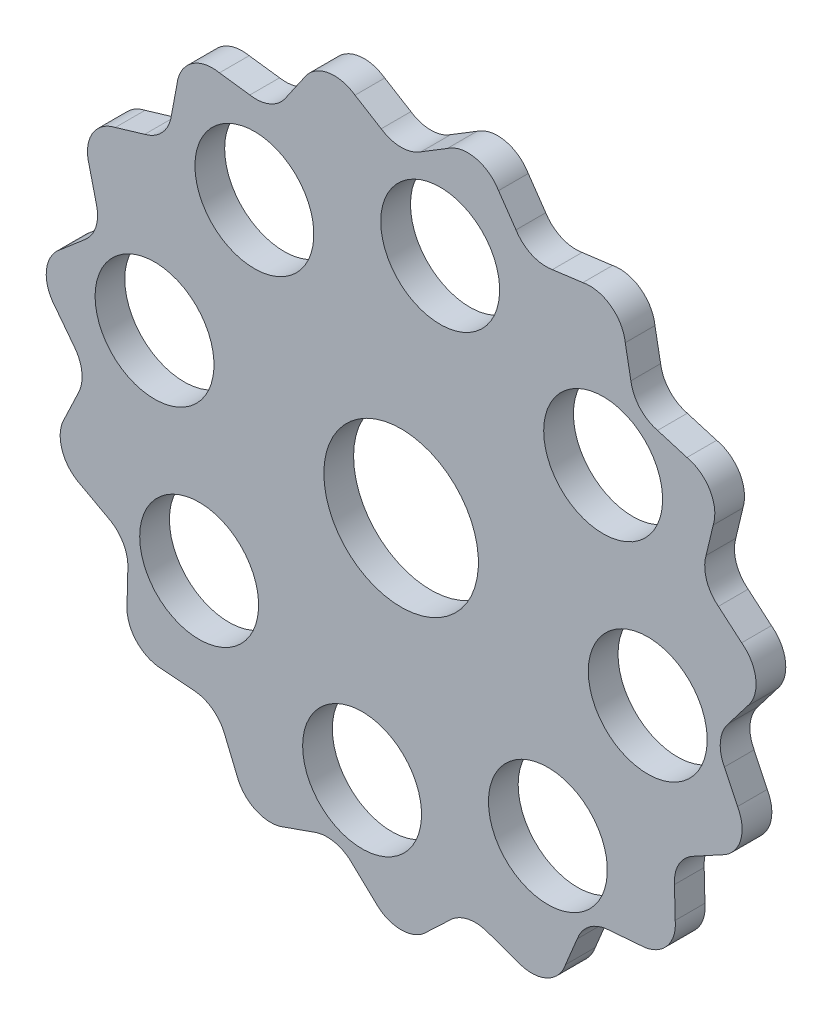
from build123d import *

# Parameters (mm, degrees)
BOSS_EXTRU_1_DEPTH      = 5
ESQUISSE2_R             = 13
ESQUISSE2_R_2           = 10
ENL_V_MAT_EXTRU_1_DEPTH = 85.791446444


with BuildPart() as part:
    # Esquisse1 → Boss.-Extru.1 (new body)
    with BuildSketch(Plane.XY):
        with BuildLine():
            Line((-7.756063007, 57.713945373), (-3.353460657, 55.024630504))
            ThreePointArc((-3.353460657, 55.024630504), (0, 54), (3.353460657, 55.024630504))
            Line((3.353460657, 55.024630504), (7.756063007, 57.713945373))
            ThreePointArc((7.756063007, 57.713945373), (10.013220978, 58.695868578), (12.474701449, 58.688856044))
            ThreePointArc((12.474701449, 58.688856044), (14.726228007, 57.694088008), (16.388860271, 55.878987669))
            Line((16.388860271, 55.878987669), (19.316994747, 51.631476586))
            ThreePointArc((19.316994747, 51.631476586), (21.963778726, 49.331454713), (25.444072249, 48.903525925))
            Line((25.444072249, 48.903525925), (30.559892529, 49.569637607))
            ThreePointArc((30.559892529, 49.569637607), (33.021293088, 49.548600235), (35.267115138, 48.541019662))
            ThreePointArc((35.267115138, 48.541019662), (36.919378386, 46.716475488), (37.700000719, 44.382045352))
            Line((37.700000719, 44.382045352), (38.64736627, 39.310771309))
            ThreePointArc((38.64736627, 39.310771309), (40.129820576, 36.133052743), (43.135172596, 34.326557439))
            Line((43.135172596, 34.326557439), (48.079639004, 32.854289173))
            ThreePointArc((48.079639004, 32.854289173), (50.319683635, 31.833928776), (51.961524227, 30))
            ThreePointArc((51.961524227, 30), (52.72883284, 27.66115995), (52.49246855, 25.211044196))
            Line((52.49246855, 25.211044196), (51.295257065, 20.192876545))
            ThreePointArc((51.295257065, 20.192876545), (51.35705188, 16.686917696), (53.367809731, 13.814215325))
            Line((53.367809731, 13.814215325), (57.285979107, 10.45813567))
            ThreePointArc((57.285979107, 10.45813567), (58.917343741, 8.61488183), (59.671313722, 6.271707796))
            ThreePointArc((59.671313722, 6.271707796), (59.420993069, 3.822978563), (58.208511689, 1.680824463))
            Line((58.208511689, 1.680824463), (55.07373191, -2.416550019))
            ThreePointArc((55.07373191, -2.416550019), (53.70418235, -5.644537016), (54.372667732, -9.086730118))
            Line((54.372667732, -9.086730118), (56.587052995, -13.746324501))
            ThreePointArc((56.587052995, -13.746324501), (57.327659867, -16.093756448), (57.063390978, -18.541019662))
            ThreePointArc((57.063390978, -18.541019662), (55.838723774, -20.676230548), (53.859774349, -22.14002509))
            Line((53.859774349, -22.14002509), (49.329458179, -24.608133132))
            ThreePointArc((49.329458179, -24.608133132), (46.765371804, -27), (45.975997522, -30.416497372))
            Line((45.975997522, -30.416497372), (46.103711342, -35.573920284))
            ThreePointArc((46.103711342, -35.573920284), (45.825502796, -38.019638029), (44.588689529, -40.147836382))
            ThreePointArc((44.588689529, -40.147836382), (42.60143186, -41.60033156), (40.198192724, -42.132663168))
            Line((40.198192724, -42.132663168), (35.055672985, -42.544746469))
            ThreePointArc((35.055672985, -42.544746469), (31.740403624, -43.686917696), (29.629659661, -46.486975906))
            Line((29.629659661, -46.486975906), (27.64861916, -51.25046207))
            ThreePointArc((27.64861916, -51.25046207), (26.399699981, -53.371578798), (24.404198585, -54.812727459))
            ThreePointArc((24.404198585, -54.812727459), (21.997965355, -55.331357318), (19.585978387, -54.840181022))
            Line((19.585978387, -54.840181022), (14.720443461, -53.124986634))
            ThreePointArc((14.720443461, -53.124986634), (11.227231304, -52.81997044), (8.160084469, -54.519433984))
            Line((8.160084469, -54.519433984), (4.412829545, -58.065333369))
            ThreePointArc((4.412829545, -58.065333369), (2.409149205, -59.495088726), (0, -60))
            ThreePointArc((0, -60), (-2.409149205, -59.495088726), (-4.412829545, -58.065333369))
            Line((-4.412829545, -58.065333369), (-8.160084469, -54.519433984))
            ThreePointArc((-8.160084469, -54.519433984), (-11.227231304, -52.81997044), (-14.720443461, -53.124986634))
            Line((-14.720443461, -53.124986634), (-19.585978387, -54.840181022))
            ThreePointArc((-19.585978387, -54.840181022), (-21.997965355, -55.331357318), (-24.404198585, -54.812727459))
            ThreePointArc((-24.404198585, -54.812727459), (-26.399699981, -53.371578798), (-27.64861916, -51.25046207))
            Line((-27.64861916, -51.25046207), (-29.629659661, -46.486975906))
            ThreePointArc((-29.629659661, -46.486975906), (-31.740403624, -43.686917696), (-35.055672985, -42.544746469))
            Line((-35.055672985, -42.544746469), (-40.198192724, -42.132663168))
            ThreePointArc((-40.198192724, -42.132663168), (-42.60143186, -41.60033156), (-44.588689529, -40.147836382))
            ThreePointArc((-44.588689529, -40.147836382), (-45.825502796, -38.019638029), (-46.103711342, -35.573920284))
            Line((-46.103711342, -35.573920284), (-45.975997522, -30.416497372))
            ThreePointArc((-45.975997522, -30.416497372), (-46.765371804, -27), (-49.329458179, -24.608133132))
            Line((-49.329458179, -24.608133132), (-53.859774349, -22.14002509))
            ThreePointArc((-53.859774349, -22.14002509), (-55.838723774, -20.676230548), (-57.063390978, -18.541019662))
            ThreePointArc((-57.063390978, -18.541019662), (-57.327659867, -16.093756448), (-56.587052995, -13.746324501))
            Line((-56.587052995, -13.746324501), (-54.372667732, -9.086730118))
            ThreePointArc((-54.372667732, -9.086730118), (-53.70418235, -5.644537016), (-55.07373191, -2.416550019))
            Line((-55.07373191, -2.416550019), (-58.208511689, 1.680824463))
            ThreePointArc((-58.208511689, 1.680824463), (-59.420993069, 3.822978563), (-59.671313722, 6.271707796))
            ThreePointArc((-59.671313722, 6.271707796), (-58.917343741, 8.61488183), (-57.285979107, 10.45813567))
            Line((-57.285979107, 10.45813567), (-53.367809731, 13.814215325))
            ThreePointArc((-53.367809731, 13.814215325), (-51.35705188, 16.686917696), (-51.295257065, 20.192876545))
            Line((-51.295257065, 20.192876545), (-52.49246855, 25.211044196))
            ThreePointArc((-52.49246855, 25.211044196), (-52.72883284, 27.66115995), (-51.961524227, 30))
            ThreePointArc((-51.961524227, 30), (-50.319683635, 31.833928776), (-48.079639004, 32.854289173))
            Line((-48.079639004, 32.854289173), (-43.135172596, 34.326557439))
            ThreePointArc((-43.135172596, 34.326557439), (-40.129820576, 36.133052743), (-38.64736627, 39.310771309))
            Line((-38.64736627, 39.310771309), (-37.700000719, 44.382045352))
            ThreePointArc((-37.700000719, 44.382045352), (-36.919378386, 46.716475488), (-35.267115138, 48.541019662))
            ThreePointArc((-35.267115138, 48.541019662), (-33.021293088, 49.548600235), (-30.559892529, 49.569637607))
            Line((-30.559892529, 49.569637607), (-25.444072249, 48.903525925))
            ThreePointArc((-25.444072249, 48.903525925), (-21.963778726, 49.331454713), (-19.316994747, 51.631476586))
            Line((-19.316994747, 51.631476586), (-16.388860271, 55.878987669))
            ThreePointArc((-16.388860271, 55.878987669), (-14.726228007, 57.694088008), (-12.474701449, 58.688856044))
            ThreePointArc((-12.474701449, 58.688856044), (-10.013220978, 58.695868578), (-7.756063007, 57.713945373))
        make_face()
    extrude(amount=BOSS_EXTRU_1_DEPTH)

    # Esquisse2 → Enlèv. mat.-Extru.1 (cut, through all)
    with BuildSketch(Plane(origin=(0, 0, 0), x_dir=(-1, 0, 0), z_dir=(0, 0, -1))):
        Circle(ESQUISSE2_R)
        with Locations((24.686980596, 33.978713764)):
            Circle(ESQUISSE2_R_2)
        with Locations((41.482910305, 6.570247532)):
            Circle(ESQUISSE2_R_2)
        with Locations((33.978713764, -24.686980596)):
            Circle(ESQUISSE2_R_2)
        with Locations((6.570247532, -41.482910305)):
            Circle(ESQUISSE2_R_2)
        with Locations((-24.686980596, -33.978713764)):
            Circle(ESQUISSE2_R_2)
        with Locations((-41.482910305, -6.570247532)):
            Circle(ESQUISSE2_R_2)
        with Locations((-33.978713764, 24.686980596)):
            Circle(ESQUISSE2_R_2)
        with Locations((-6.570247532, 41.482910305)):
            Circle(ESQUISSE2_R_2)
    extrude(amount=-ENL_V_MAT_EXTRU_1_DEPTH, mode=Mode.SUBTRACT)


solid = part.part
